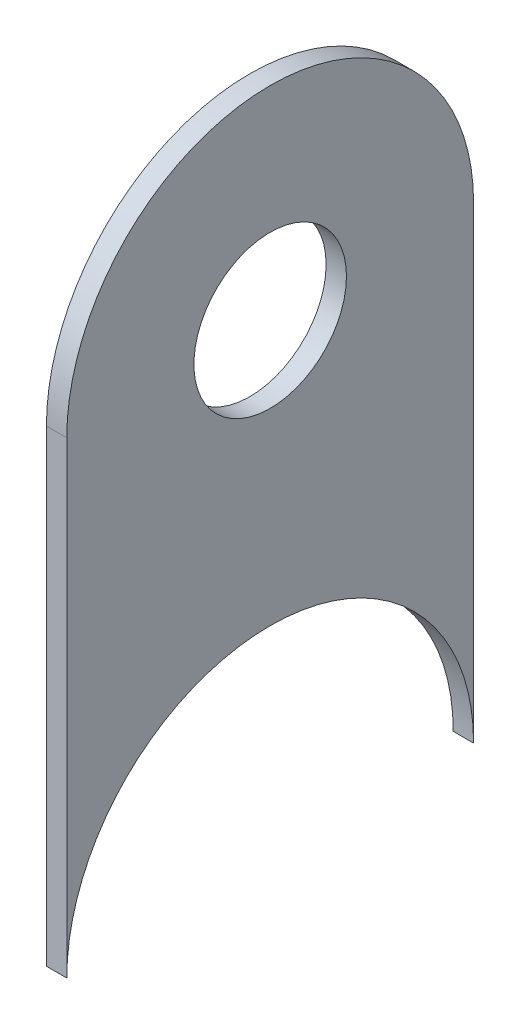
from build123d import *

# Parameters (mm, degrees)
SKETCH1_R           = 4.7625
BOSS_EXTRUDE1_DEPTH = 1.27


with BuildPart() as part:
    # Sketch1 → Boss-Extrude1 (new body)
    with BuildSketch(Plane(origin=(0, 0, 0), x_dir=(0, 0, -1), z_dir=(1, 0, 0))):
        with BuildLine():
            Line((-12.7, 0), (-12.7, -29.21))
            ThreePointArc((-12.7, -29.21), (0, -16.51), (12.7, -29.21))
            Line((12.7, -29.21), (12.7, 0))
            ThreePointArc((12.7, 0), (0, 12.7), (-12.7, 0))
        make_face()
        Circle(SKETCH1_R, mode=Mode.SUBTRACT)
    extrude(amount=BOSS_EXTRUDE1_DEPTH)


solid = part.part
